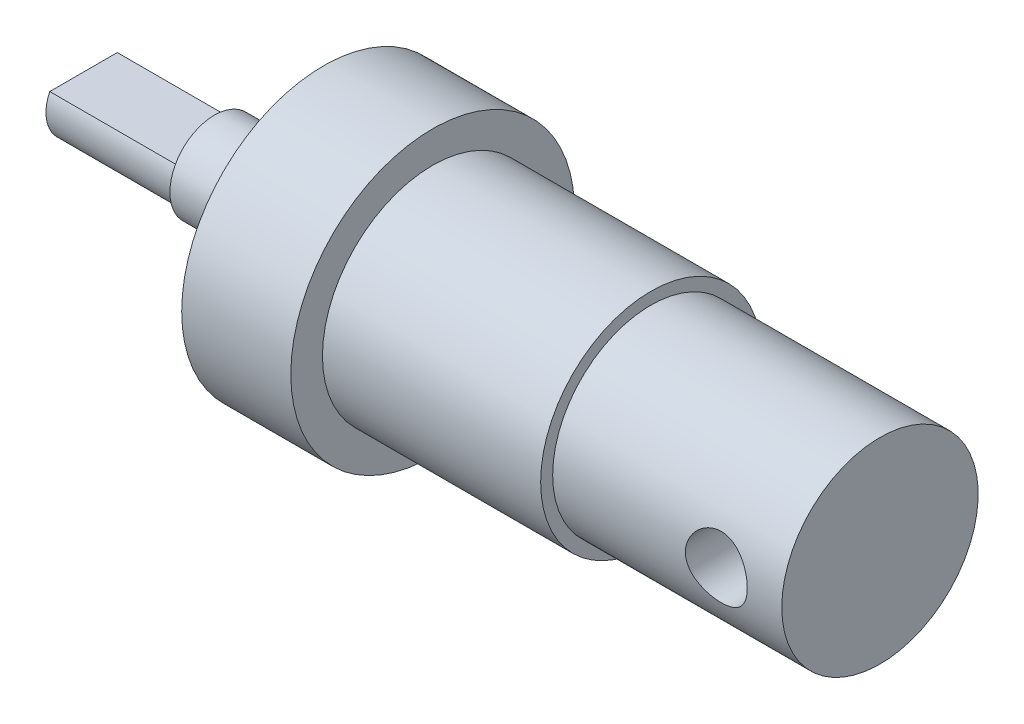
from build123d import *

# Parameters (mm, degrees)
EXTRUDE_2_DEPTH = 11
SKETCH_5_R      = 2.04
EXTRUDE_3_DEPTH = 5


with BuildPart() as part:
    # 草图1 → 旋转1 (revolve)
    with BuildSketch(Plane.XY, mode=Mode.PRIVATE) as revolve_1_sk:
        Polygon((-5, 0), (0, 0), (20.5, 0), (20.5, 4.5), (10, 4.5), (10, 5.05), (0, 5.05), (0, 6.5), (-5, 6.5), (-5, 5), align=None)
    revolve(revolve_1_sk.sketch.rotate(Axis((-5, 0, 0), (1, 0, 0)), 90), axis=Axis((-5, 0, 0), (1, 0, 0)))

    # 草图3 → 切除-旋转1 (revolve, cut)
    with BuildSketch(Plane(origin=(17.5, 0, 0), x_dir=(0, 0, -1), z_dir=(1, 0, 0)), mode=Mode.PRIVATE) as cut_revolve_1_sk:
        Polygon((-6.680542038, 0), (-6.680542038, 1.407519777), (7.599960071, 1.407519777), (7.599960071, -0.067480223), align=None)
    revolve(cut_revolve_1_sk.sketch.rotate(Axis((17.5, 0, 6.680542038), (0, -0.0047252868789963, -0.9999888357696356)), 270.416383372), axis=Axis((17.5, 0, 6.680542038), (0, -0.0047252868789963, -0.9999888357696356)), mode=Mode.SUBTRACT)

    # 草图4 → 凸台-拉伸2 (add)
    with BuildSketch(Plane.ZY.offset(5)):
        with BuildLine():
            Line((0.04652715, 0.75), (0, 0.75))
            Line((0, 0.75), (-1.547869504, 0.75))
            ThreePointArc((-1.547869504, 0.75), (0, -1.72), (1.547869504, 0.75))
            Line((1.547869504, 0.75), (0.04652715, 0.75))
        make_face()
    extrude(amount=EXTRUDE_2_DEPTH)

    # 草图5 → 凸台-拉伸3 (add)
    with BuildSketch(Plane.ZY.offset(5)):
        with Locations(Location((0, 0, 0), (0, 0, 180))):
            Circle(SKETCH_5_R)
    extrude(amount=EXTRUDE_3_DEPTH)


solid = part.part
